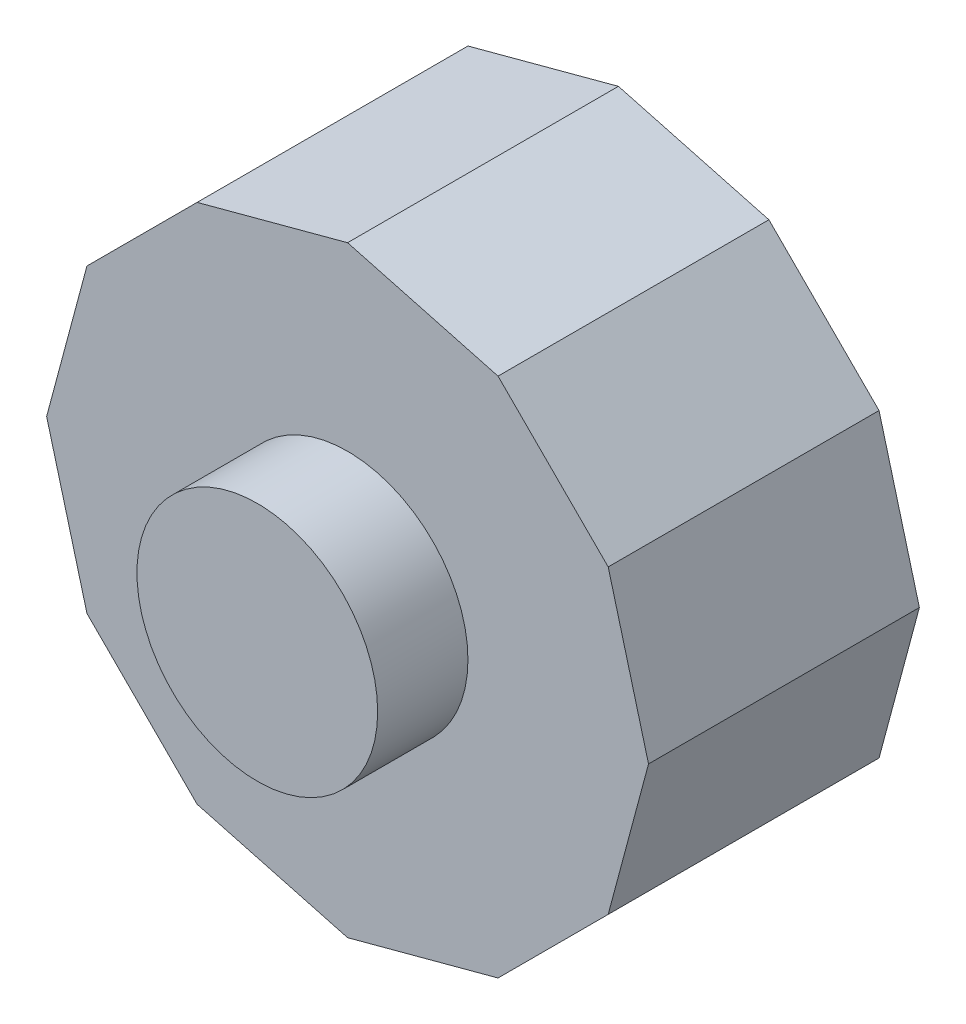
from build123d import *

# Parameters (mm, degrees)
SKETCH_1_R          = 8
EXTRUDE_1_DEPTH     = 24
SKETCH_2_R          = 42
EXTRUDE_2_DEPTH     = 18
SKETCH_3_OUTSIDE_W  = 110.238
SKETCH_3_OUTSIDE_H  = 110.238
CUT_EXTRUDE_1_DEPTH = 63.064482597


with BuildPart() as part:
    # 草图1 → 凸台-拉伸1 (new body)
    with BuildSketch(Plane.XY):
        Circle(SKETCH_1_R)
    extrude(amount=EXTRUDE_1_DEPTH)

    # 草图2 → 凸台-拉伸2 (add)
    with BuildSketch(Plane.XY):
        Circle(SKETCH_2_R)
    extrude(amount=EXTRUDE_2_DEPTH)

    # 草图3 outside → 切除-拉伸1 (cut, through all)
    with BuildSketch(Plane.XY.offset(18)):
        Rectangle(SKETCH_3_OUTSIDE_W, SKETCH_3_OUTSIDE_H)
        Polygon((20, 0), (17.320508076, 10), (10, 17.320508076), (0, 20), (-10, 17.320508076), (-17.320508076, 10), (-20, 0), (-17.320508076, -10), (-10, -17.320508076), (0, -20), (10, -17.320508076), (17.320508076, -10), align=None, mode=Mode.SUBTRACT)
    extrude(amount=-CUT_EXTRUDE_1_DEPTH, mode=Mode.SUBTRACT)


solid = part.part
